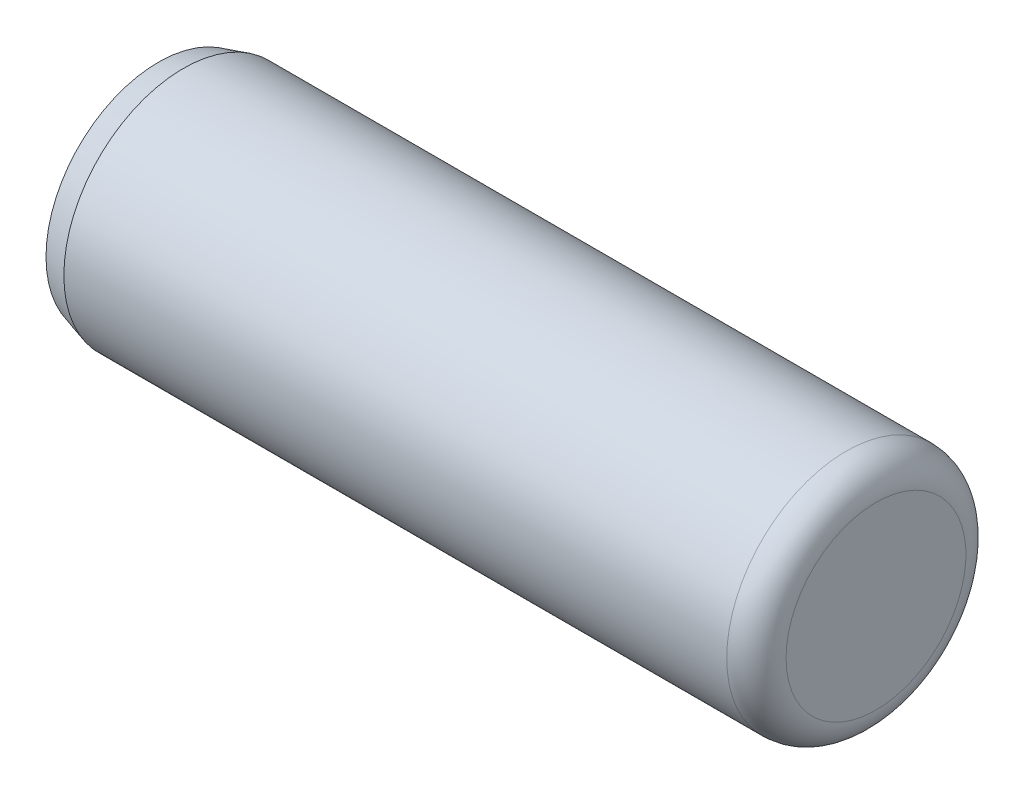
from build123d import *


with BuildPart() as part:
    # Sketch3 → Revolve1 (revolve)
    with BuildSketch(Plane.XY, mode=Mode.PRIVATE) as revolve1_sk:
        with BuildLine():
            Line((9.525, 2.3876), (9.525, 0))
            Line((9.525, 0), (-9.525, 0))
            Line((-9.525, 0), (-9.525, 2.9845))
            Line((-9.525, 2.9845), (-8.860647548, 3.175))
            Line((-8.860647548, 3.175), (8.7376, 3.175))
            ThreePointArc((8.7376, 3.175), (9.29437588, 2.94437588), (9.525, 2.3876))
        make_face()
    revolve(revolve1_sk.sketch.rotate(Axis((-9.525, 0, 0), (1, 0, 0)), 90), axis=Axis((-9.525, 0, 0), (1, 0, 0)))


solid = part.part
